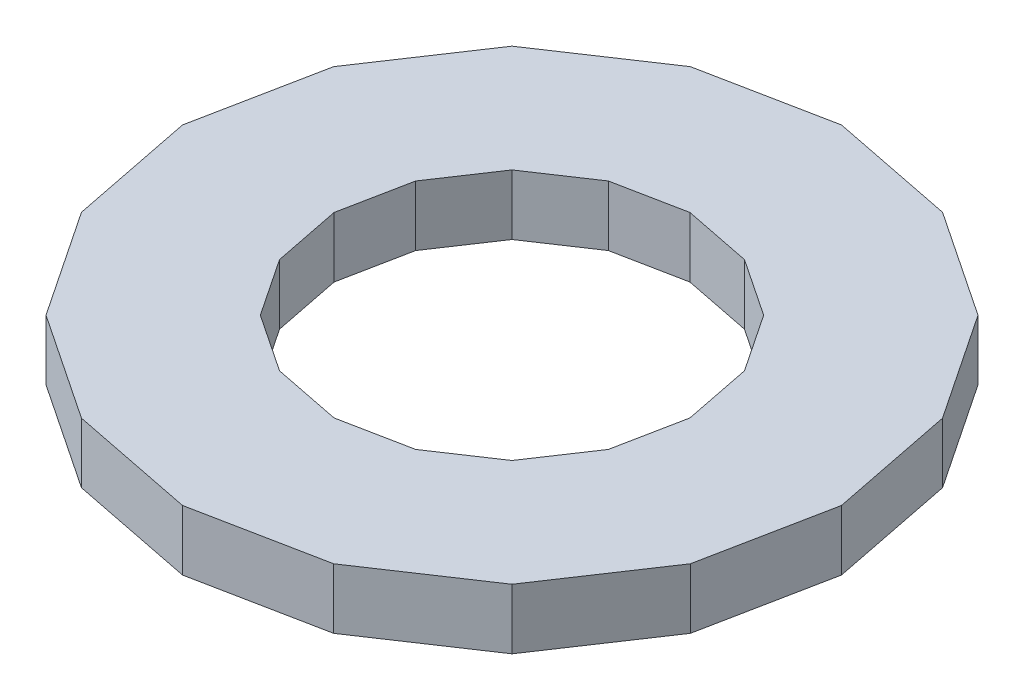
from build123d import *

# Parameters (mm, degrees)
BOSS_EXTRUDE1_DEPTH = 19.05


with BuildPart() as part:
    # Sketch1 → Boss-Extrude1 (new body)
    with BuildSketch(Plane(origin=(0, 0, 0), x_dir=(1, 0, 0), z_dir=(0, 1, 0))):
        Polygon((104.156883796, 0), (96.228413109, 39.859113796), (73.65003884, 73.65003884), (39.859113796, 96.228413109), (0, 104.156883796), (-39.859113796, 96.228413109), (-73.65003884, 73.65003884), (-96.228413109, 39.859113796), (-104.156883796, 0), (-96.228413109, -39.859113796), (-73.65003884, -73.65003884), (-39.859113796, -96.228413109), (0, -104.156883796), (39.859113796, -96.228413109), (73.65003884, -73.65003884), (96.228413109, -39.859113796), align=None)
        Polygon((56.246295272, 0), (51.964800981, 21.524525333), (39.772136803, 39.772136803), (21.524525333, 51.964800981), (0, 56.246295272), (-21.524525333, 51.964800981), (-39.772136803, 39.772136803), (-51.964800981, 21.524525333), (-56.246295272, 0), (-51.964800981, -21.524525333), (-39.772136803, -39.772136803), (-21.524525333, -51.964800981), (0, -56.246295272), (21.524525333, -51.964800981), (39.772136803, -39.772136803), (51.964800981, -21.524525333), align=None, mode=Mode.SUBTRACT)
    extrude(amount=BOSS_EXTRUDE1_DEPTH)


solid = part.part
